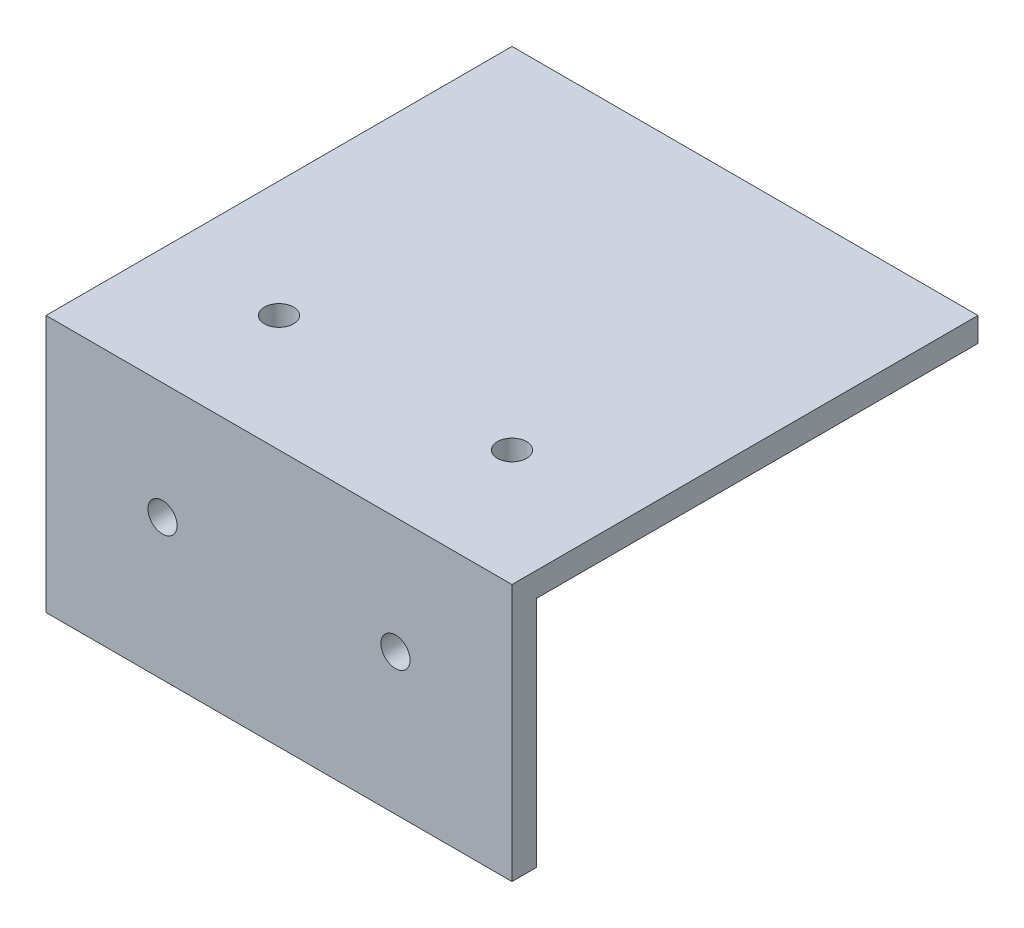
from build123d import *

# Parameters (mm, degrees)
SKETCH3_W                 = 60.96
SKETCH3_H                 = 60.96
BOSS_EXTRUDE1_DEPTH       = 3.175
F_6_0_15_DIAMETER_HOLE1_D = 3.81
SKETCH6_W                 = 60.96
SKETCH6_H                 = 3.175
BOSS_EXTRUDE3_DEPTH       = 30.48
F_6_0_15_DIAMETER_HOLE2_D = 3.81


with BuildPart() as part:
    # Sketch3 → Boss-Extrude1 (new body)
    with BuildSketch(Plane(origin=(0, 0, 0), x_dir=(1, 0, 0), z_dir=(0, 1, 0))):
        with Locations((30.48, 30.48)):
            Rectangle(SKETCH3_W, SKETCH3_H)
    extrude(amount=BOSS_EXTRUDE1_DEPTH)

    # #6 (0.15) Diameter Hole1 (through all)
    with Locations(Plane(origin=(0, 3.175, 0), x_dir=(1, 0, 0), z_dir=(0, 1, 0))):
        with Locations((15.24, 15.24), (45.72, 15.24)):
            Hole(F_6_0_15_DIAMETER_HOLE1_D / 2)

    # Sketch6 → Boss-Extrude3 (add)
    with BuildSketch(Plane.XZ):
        with Locations((30.48, -1.5875)):
            Rectangle(SKETCH6_W, SKETCH6_H)
    extrude(amount=BOSS_EXTRUDE3_DEPTH)

    # #6 (0.15) Diameter Hole2 (through all)
    with Locations(Plane.XY):
        with Locations((15.24, -12.065), (45.72, -12.065)):
            Hole(F_6_0_15_DIAMETER_HOLE2_D / 2)


solid = part.part
